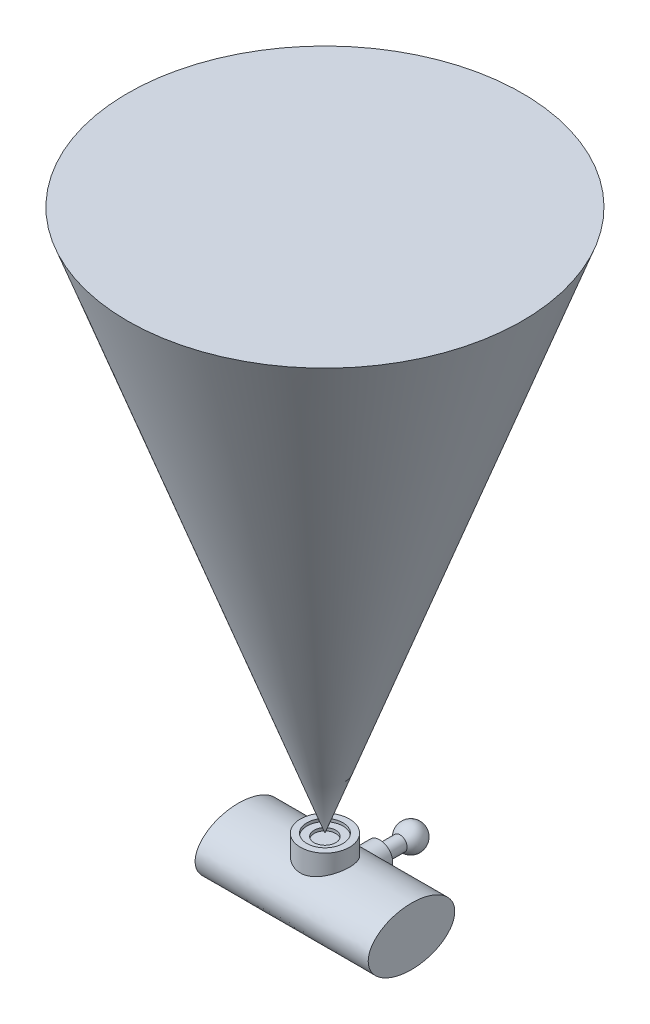
from build123d import *

# Parameters (mm, degrees)
SKETCH_1_R           = 2.5
EXTRUDE_1_DEPTH      = 7
SKETCH_2_R           = 4.5
EXTRUDE_2_DEPTH      = 10
EXTRUDE_3_DEPTH      = 30
EXTRUDE_3_DEPTH_BACK = 30
SKETCH_3_RX          = 15
SKETCH_3_RY          = 10
SKETCH_4_R           = 8.5
EXTRUDE_4_DEPTH      = 16
SKETCH_5_R           = 6.25
CUT_EXTRUDE_1_DEPTH  = 1
SKETCH_6_R           = 3.75
CUT_EXTRUDE_2_DEPTH  = 1


with BuildPart() as part:
    # 草图1 → 凸台-拉伸1 (new body)
    with BuildSketch(Plane.XY):
        Circle(SKETCH_1_R)
    extrude(amount=EXTRUDE_1_DEPTH)

    # 草图2 → 凸台-拉伸2 (add)
    with BuildSketch(Plane.XY.offset(7)):
        Circle(SKETCH_2_R)
    extrude(amount=EXTRUDE_2_DEPTH)

    # 草图3 → 凸台-拉伸3 (add, two sides: drawn at the far end of the back side and taken through both)
    with BuildSketch(Plane(origin=(0, 0, 0), x_dir=(0, 0, -1), z_dir=(1, 0, 0)).offset(-EXTRUDE_3_DEPTH_BACK)):
        with Locations((-26, 0)):
            Ellipse(SKETCH_3_RX, SKETCH_3_RY)
    extrude(amount=EXTRUDE_3_DEPTH + EXTRUDE_3_DEPTH_BACK)

    # 草图4 → 凸台-拉伸4 (add)
    with BuildSketch(Plane(origin=(0, 0, 0), x_dir=(1, 0, 0), z_dir=(0, 1, 0))):
        with Locations((0, -26)):
            Circle(SKETCH_4_R)
    extrude(amount=EXTRUDE_4_DEPTH)

    # 草图5 → 切除-拉伸1 (cut)
    with BuildSketch(Plane(origin=(0, 16, 0), x_dir=(1, 0, 0), z_dir=(0, 1, 0))):
        with Locations((0, -26)):
            Circle(SKETCH_5_R)
    extrude(amount=-CUT_EXTRUDE_1_DEPTH, mode=Mode.SUBTRACT)

    # 草图6 → 切除-拉伸2 (cut)
    with BuildSketch(Plane(origin=(0, 15, 0), x_dir=(1, 0, 0), z_dir=(0, 1, 0))):
        with Locations((0, -26)):
            Circle(SKETCH_6_R)
    extrude(amount=-CUT_EXTRUDE_2_DEPTH, mode=Mode.SUBTRACT)

    # 草图7 → 旋转3 (revolve)
    with BuildSketch(Plane(origin=(0, 0, 0), x_dir=(1, 0, 0), z_dir=(0, 1, 0))):
        with BuildLine():
            Line((0, -0.758342613), (0, 8.241657387))
            ThreePointArc((0, 8.241657387), (4.5, 3.741657387), (0, -0.758342613))
        make_face()
    revolve(axis=Axis((0, 0, -10.703740256), (0, 0, 1)))


with BuildPart() as body_2:
    # 草图8 → 旋转4 (revolve)
    with BuildSketch(Plane(origin=(0, 0, 0), x_dir=(0, 0, -1), z_dir=(1, 0, 0))):
        Polygon((-26, 16), (42.404028665, 203.938524157), (-26, 203.938524157), align=None)
    revolve(axis=Axis((0, 203.938524157, 26), (0, -1, 0)))


solid = Compound([part.part, body_2.part])
